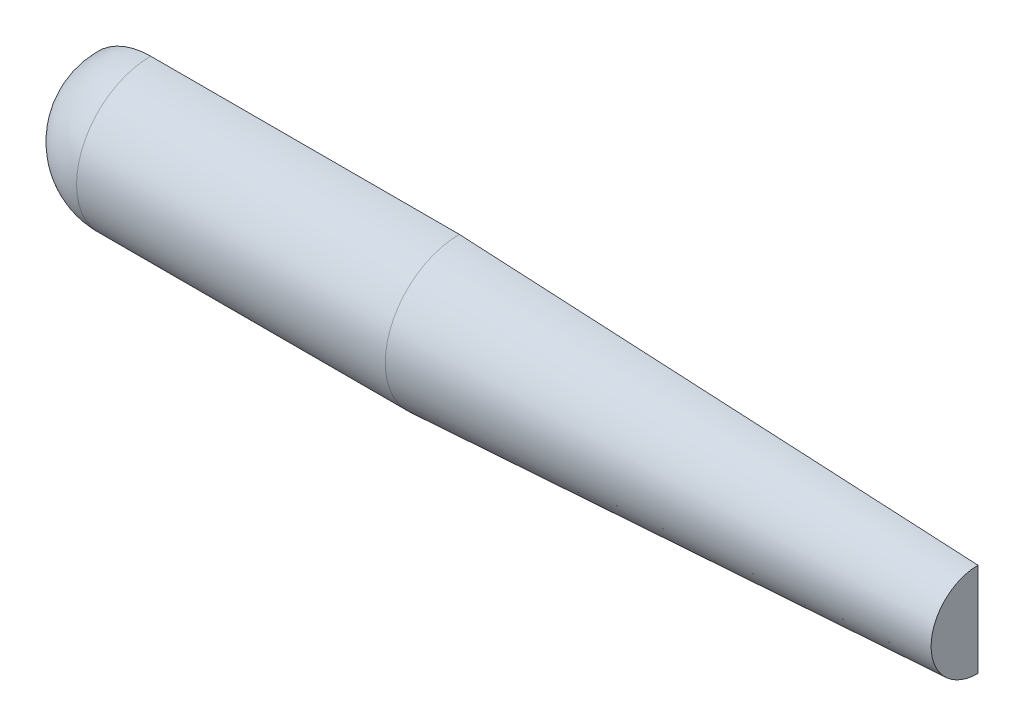
from build123d import *

# Parameters (mm, degrees)
SKETCH1_R                = 15.24
EXTRUDE1_DEPTH           = 106.68
EXTRUDE1_TAPER           = 3
EXTRUDE1_OTHER_WAY_DEPTH = 63.5
DOME1_FACE_RADIUS        = 15.24
DOME1_HEIGHT             = 15.24
EXTRUDE2_DEPTH           = 110.904540983
EXTRUDE2_DEPTH_BACK      = 110.904540983


with BuildPart() as part:
    # Sketch1 → Extrude1 (new body)
    with BuildSketch(Plane(origin=(0, 0, 0), x_dir=(0, 0, -1), z_dir=(1, 0, 0))):
        with Locations((0, 6.35)):
            Circle(SKETCH1_R)
    extrude(amount=EXTRUDE1_DEPTH, taper=EXTRUDE1_TAPER)

    # Sketch1 → Extrude1 other way (add)
    with BuildSketch(Plane(origin=(0, 0, 0), x_dir=(0, 0, -1), z_dir=(1, 0, 0))):
        with Locations((0, 6.35)):
            Circle(SKETCH1_R)
    extrude(amount=-EXTRUDE1_OTHER_WAY_DEPTH)

    # Dome1: a dome of height H over a round flat face of radius A is a cap of a sphere of radius (A * A + H * H) / (2 * H)
    dome1_r = (DOME1_FACE_RADIUS * DOME1_FACE_RADIUS + DOME1_HEIGHT * DOME1_HEIGHT) / (2 * DOME1_HEIGHT)
    dome1_base = Plane((-63.5, 6.35, 0), z_dir=(-1, 0, 0))
    with Locations(dome1_base.offset(DOME1_HEIGHT - dome1_r)):
        dome1_ball = Sphere(dome1_r, mode=Mode.PRIVATE)
    add(split(dome1_ball, bisect_by=dome1_base, keep=Keep.TOP, mode=Mode.PRIVATE))

    # Sketch3 → Extrude2 (cut, two sides: drawn at the far end of the back side and taken through both)
    with BuildSketch(Plane(origin=(0, 0, 0), x_dir=(0, 0, -1), z_dir=(1, 0, 0)).offset(-EXTRUDE2_DEPTH_BACK)):
        Polygon((0, 142.420252654), (0, 34.177667736), (0, -25.107363528), (0, -133.349948446), (216.485169836, -133.349948446), (216.485169836, 142.420252654), align=None)
    extrude(amount=EXTRUDE2_DEPTH + EXTRUDE2_DEPTH_BACK, mode=Mode.SUBTRACT)


solid = part.part
